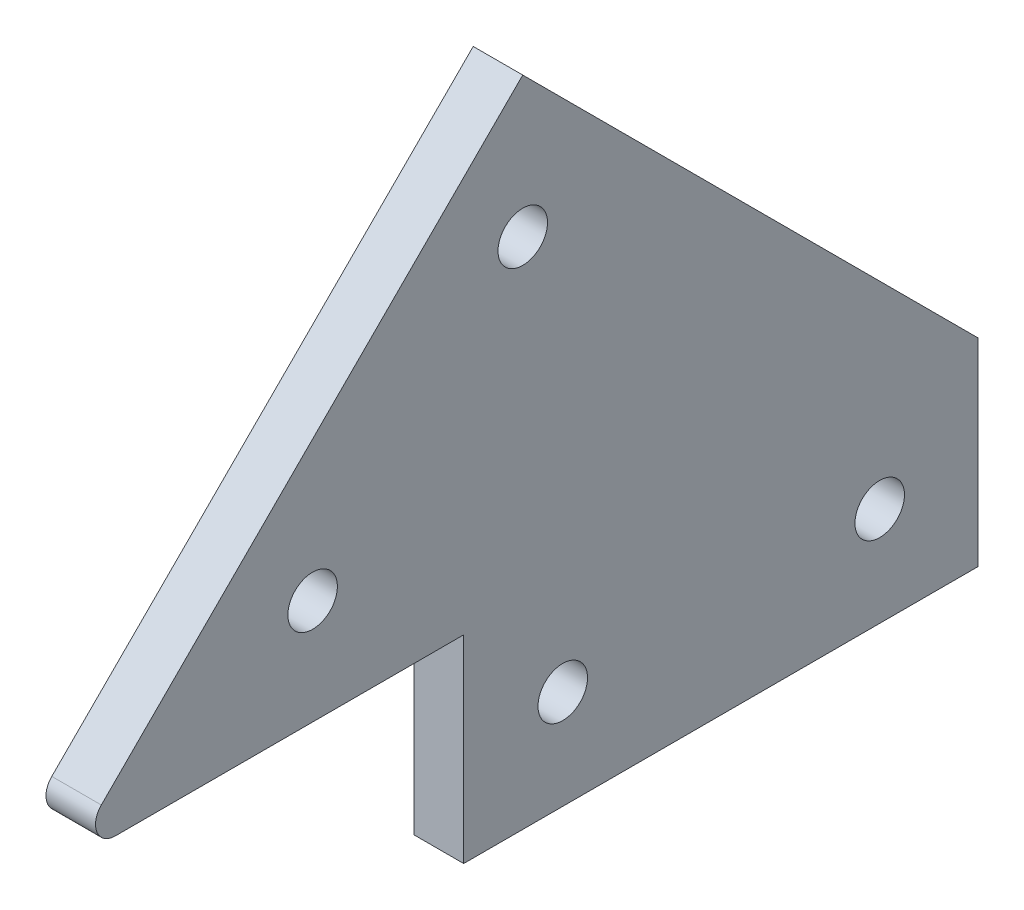
from build123d import *

# Parameters (mm, degrees)
SKETCH_1_R      = 2.5
EXTRUDE_1_DEPTH = 5
FILLET_1_R      = 2


with BuildPart() as part:
    # 草图1 → 凸台-拉伸1 (new body)
    with BuildSketch(Plane(origin=(0, 0, 0), x_dir=(0, 0, -1), z_dir=(1, 0, 0))):
        Polygon((-159.038059223, 45.961940777), (-113.076118446, 0), (-113.076118446, -20), (-165, -20), (-165, 0), (-205, 0), align=None)
        with Locations((-155, -10)):
            Circle(SKETCH_1_R, mode=Mode.SUBTRACT)
        with Locations((-123, -10)):
            Circle(SKETCH_1_R, mode=Mode.SUBTRACT)
        with Locations((-180.251262658, 10.606601718)):
            Circle(SKETCH_1_R, mode=Mode.SUBTRACT)
        with Locations((-159.038059223, 31.819805153)):
            Circle(SKETCH_1_R, mode=Mode.SUBTRACT)
    extrude(amount=EXTRUDE_1_DEPTH)

    # 圆角1
    fillet_1_edges = [part.edges().sort_by_distance(p)[0] for p in [
        (2.5, 0, 205),
    ]]
    fillet(fillet_1_edges, radius=FILLET_1_R)


solid = part.part
